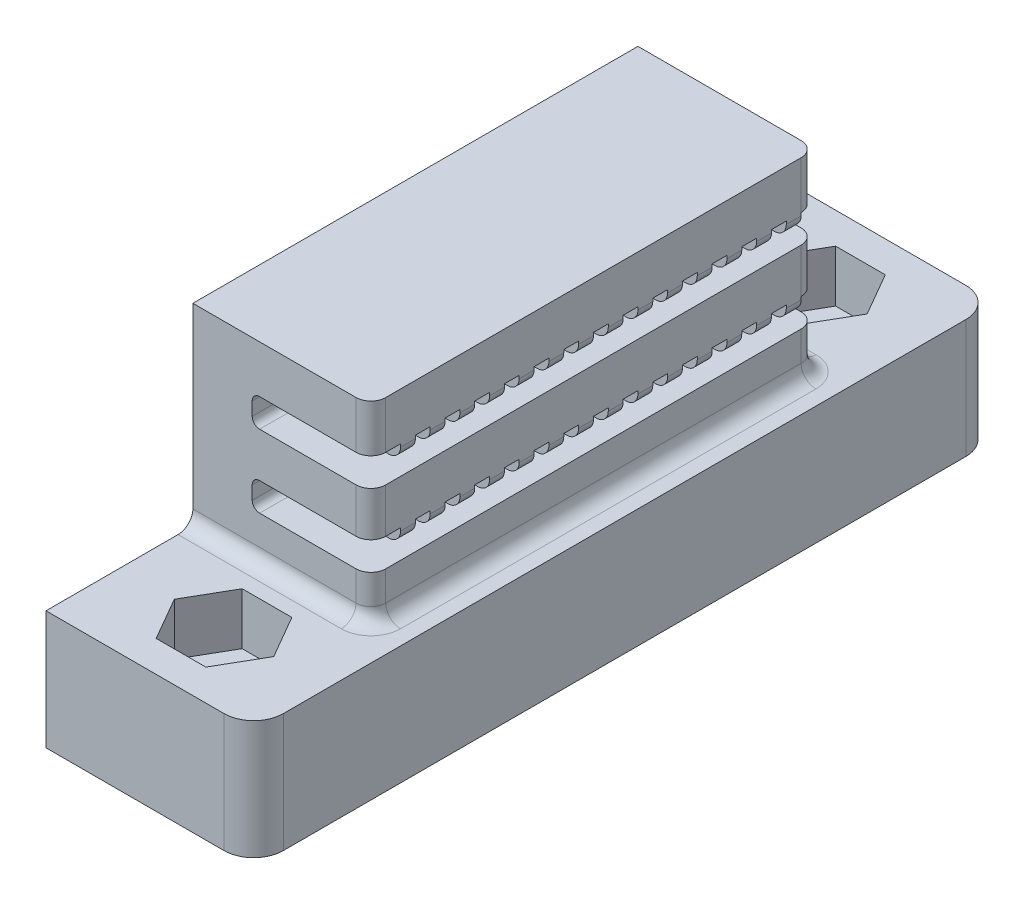
from build123d import *

# Parameters (mm, degrees)
CROQUIS1_W              = 14
CROQUIS1_H              = 50
CROQUIS1_R              = 1.55
SALIENTE_EXTRUIR1_DEPTH = 8
CORTAR_EXTRUIR1_DEPTH   = 3.5
CROQUIS3_W              = 14
CROQUIS3_H              = 30
SALIENTE_EXTRUIR3_DEPTH = 13
CORTAR_EXTRUIR2_DEPTH   = 10
CROQUIS5_W              = 30
CROQUIS5_H              = 13
CORTAR_EXTRUIR3_DEPTH   = 2
REDONDEO1_R             = 0.8
REDONDEO2_R             = 2
REDONDEO3_R             = 1
REDONDEO4_R             = 1
REDONDEO5_R             = 0.5


with BuildPart() as part:
    # Croquis1 → Saliente-Extruir1 (new body)
    with BuildSketch(Plane(origin=(0, 0, 0), x_dir=(1, 0, 0), z_dir=(0, 1, 0))):
        with Locations((7, 25)):
            Rectangle(CROQUIS1_W, CROQUIS1_H)
        with Locations(Location((7, 45, 0), (0, 0, 270))):
            Circle(CROQUIS1_R, mode=Mode.SUBTRACT)
        with Locations(Location((7, 5, 0), (0, 0, 90))):
            Circle(CROQUIS1_R, mode=Mode.SUBTRACT)
    extrude(amount=SALIENTE_EXTRUIR1_DEPTH)

    # Croquis2 → Cortar-Extruir1 (cut)
    with BuildSketch(Plane(origin=(0, 8, 0), x_dir=(1, 0, 0), z_dir=(0, 1, 0))):
        Polygon((10.348631561, 45), (8.674315781, 47.9), (5.325684219, 47.9), (3.651368439, 45), (5.325684219, 42.1), (8.674315781, 42.1), align=None)
        Polygon((10.348631561, 5), (8.674315781, 7.9), (5.325684219, 7.9), (3.651368439, 5), (5.325684219, 2.1), (8.674315781, 2.1), align=None)
    extrude(amount=-CORTAR_EXTRUIR1_DEPTH, mode=Mode.SUBTRACT)

    # Croquis3 → Saliente-Extruir3 (add)
    with BuildSketch(Plane(origin=(0, 8, 0), x_dir=(1, 0, 0), z_dir=(0, 1, 0))):
        with Locations((7, 24.9)):
            Rectangle(CROQUIS3_W, CROQUIS3_H)
    extrude(amount=SALIENTE_EXTRUIR3_DEPTH)

    # Croquis4 → Cortar-Extruir2 (cut)
    with BuildSketch(Plane(origin=(14, 0, 0), x_dir=(0, 0, -1), z_dir=(1, 0, 0))):
        Polygon((39.9, 17.8), (38.9, 17.8), (38.9, 16.8), (37.9, 16.8), (37.9, 17.8), (36.9, 17.8), (36.9, 16.8), (35.9, 16.8), (35.9, 17.8), (34.9, 17.8), (34.9, 16.8), (33.9, 16.8), (33.9, 17.8), (32.9, 17.8), (32.9, 16.8), (31.9, 16.8), (31.9, 17.8), (30.9, 17.8), (30.9, 16.8), (29.9, 16.8), (29.9, 17.8), (28.9, 17.8), (28.9, 16.8), (27.9, 16.8), (27.9, 17.8), (26.9, 17.8), (26.9, 16.8), (25.9, 16.8), (25.9, 17.8), (24.9, 17.8), (24.9, 16.8), (23.9, 16.8), (23.9, 17.8), (22.9, 17.8), (22.9, 16.8), (21.9, 16.8), (21.9, 17.8), (20.9, 17.8), (20.9, 16.8), (19.9, 16.8), (19.9, 17.8), (18.9, 17.8), (18.9, 16.8), (17.9, 16.8), (17.9, 17.8), (16.9, 17.8), (16.9, 16.8), (15.9, 16.8), (15.9, 17.8), (14.9, 17.8), (14.9, 16.8), (13.9, 16.8), (13.9, 17.8), (12.9, 17.8), (12.9, 16.8), (11.9, 16.8), (11.9, 17.8), (9.9, 17.8), (9.9, 15.9), (39.9, 15.9), align=None)
        Polygon((39.9, 12.9), (38.9, 12.9), (38.9, 11.9), (37.9, 11.9), (37.9, 12.9), (36.9, 12.9), (36.9, 11.9), (35.9, 11.9), (35.9, 12.9), (34.9, 12.9), (34.9, 11.9), (33.9, 11.9), (33.9, 12.9), (32.9, 12.9), (32.9, 11.9), (31.9, 11.9), (31.9, 12.9), (30.9, 12.9), (30.9, 11.9), (29.9, 11.9), (29.9, 12.9), (28.9, 12.9), (28.9, 11.9), (27.9, 11.9), (27.9, 12.9), (26.9, 12.9), (26.9, 11.9), (25.9, 11.9), (25.9, 12.9), (24.9, 12.9), (24.9, 11.9), (23.9, 11.9), (23.9, 12.9), (22.9, 12.9), (22.9, 11.9), (21.9, 11.9), (21.9, 12.9), (20.9, 12.9), (20.9, 11.9), (19.9, 11.9), (19.9, 12.9), (18.9, 12.9), (18.9, 11.9), (17.9, 11.9), (17.9, 12.9), (16.9, 12.9), (16.9, 11.9), (15.9, 11.9), (15.9, 12.9), (14.9, 12.9), (14.9, 11.9), (13.9, 11.9), (13.9, 12.9), (12.9, 12.9), (12.9, 11.9), (11.9, 11.9), (11.9, 12.9), (9.9, 12.9), (9.9, 11), (39.9, 11), align=None)
    extrude(amount=-CORTAR_EXTRUIR2_DEPTH, mode=Mode.SUBTRACT)

    # Croquis5 → Cortar-Extruir3 (cut)
    with BuildSketch(Plane(origin=(14, 0, 0), x_dir=(0, 0, -1), z_dir=(1, 0, 0))):
        with Locations((24.9, 14.5)):
            Rectangle(CROQUIS5_W, CROQUIS5_H)
    extrude(amount=-CORTAR_EXTRUIR3_DEPTH, mode=Mode.SUBTRACT)

    # Redondeo1
    redondeo1_edges = [part.edges().sort_by_distance(p)[0] for p in [
        (12, 11.9, -12.4),
        (12, 11.9, -14.4),
        (12, 11.9, -16.4),
        (12, 11.9, -18.4),
        (12, 11.9, -20.4),
        (12, 11.9, -22.4),
        (12, 11.9, -24.4),
        (12, 11.9, -26.4),
        (12, 11.9, -28.4),
        (12, 11.9, -30.4),
        (12, 11.9, -32.4),
        (12, 11.9, -34.4),
        (12, 11.9, -36.4),
        (12, 11.9, -38.4),
        (12, 16.8, -12.4),
        (12, 16.8, -14.4),
        (12, 16.8, -16.4),
        (12, 16.8, -18.4),
        (12, 16.8, -20.4),
        (12, 16.8, -22.4),
        (12, 16.8, -24.4),
        (12, 16.8, -26.4),
        (12, 16.8, -28.4),
        (12, 16.8, -30.4),
        (12, 16.8, -32.4),
        (12, 16.8, -34.4),
        (12, 16.8, -36.4),
        (12, 16.8, -38.4),
    ]]
    fillet(redondeo1_edges, radius=REDONDEO1_R)

    # Redondeo2
    redondeo2_edges = [part.edges().sort_by_distance(p)[0] for p in [
        (14, 4, -50),
        (14, 4, 0),
    ]]
    fillet(redondeo2_edges, radius=REDONDEO2_R)

    # Redondeo3
    redondeo3_edges = [part.edges().sort_by_distance(p)[0] for p in [
        (12, 9.5, -9.9),
        (12, 14.4, -9.9),
        (12, 19.4, -9.9),
        (12, 9.5, -39.9),
        (12, 14.4, -39.9),
        (12, 19.4, -39.9),
    ]]
    fillet(redondeo3_edges, radius=REDONDEO3_R)

    # Redondeo4
    redondeo4_edges = [part.edges().sort_by_distance(p)[0] for p in [
        (5.5, 8, -9.9),
        (5.5, 8, -39.9),
        (12, 8, -24.9),
        (11.707106781, 8, -39.607106781),
        (11.707106781, 8, -10.192893219),
    ]]
    fillet(redondeo4_edges, radius=REDONDEO4_R)

    # Redondeo5
    redondeo5_edges = [part.edges().sort_by_distance(p)[0] for p in [
        (4, 15.9, -24.9),
        (4, 17.8, -10.9),
        (4, 17.8, -13.4),
        (4, 17.8, -15.4),
        (4, 17.8, -17.4),
        (4, 17.8, -19.4),
        (4, 17.8, -21.4),
        (4, 17.8, -23.4),
        (4, 17.8, -25.4),
        (4, 17.8, -27.4),
        (4, 17.8, -29.4),
        (4, 17.8, -31.4),
        (4, 17.8, -33.4),
        (4, 17.8, -35.4),
        (4, 17.8, -37.4),
        (4, 17.8, -39.4),
        (4, 11, -24.9),
        (4, 12.9, -10.9),
        (4, 12.9, -13.4),
        (4, 12.9, -15.4),
        (4, 12.9, -17.4),
        (4, 12.9, -19.4),
        (4, 12.9, -21.4),
        (4, 12.9, -23.4),
        (4, 12.9, -25.4),
        (4, 12.9, -27.4),
        (4, 12.9, -29.4),
        (4, 12.9, -31.4),
        (4, 12.9, -33.4),
        (4, 12.9, -35.4),
        (4, 12.9, -37.4),
        (4, 12.9, -39.4),
    ]]
    fillet(redondeo5_edges, radius=REDONDEO5_R)


solid = part.part
